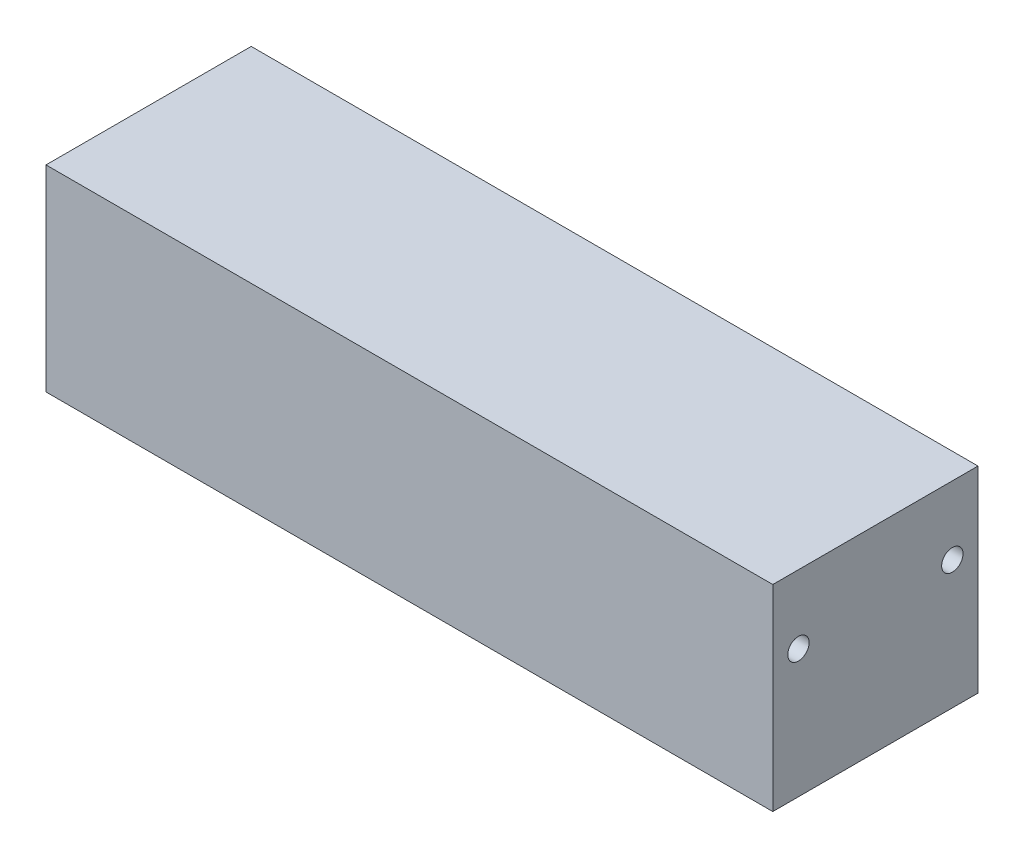
from build123d import *

# Parameters (mm, degrees)
SKETCH1_W           = 85
SKETCH1_H           = 23
BOSS_EXTRUDE1_DEPTH = 24
SKETCH3_R           = 1.25
CUT_EXTRUDE1_DEPTH  = 4
SKETCH4_R           = 1.25
CUT_EXTRUDE2_DEPTH  = 4
SKETCH5_R           = 2
BOSS_EXTRUDE3_DEPTH = 10


with BuildPart() as part:
    # Sketch1 → Boss-Extrude1 (new body)
    with BuildSketch(Plane.XY):
        Rectangle(SKETCH1_W, SKETCH1_H)
    extrude(amount=BOSS_EXTRUDE1_DEPTH)

    # Sketch3 → Cut-Extrude1 (cut)
    with BuildSketch(Plane.XZ.offset(11.5)):
        with Locations((-25, 12)):
            Circle(SKETCH3_R)
        with Locations((25, 12)):
            Circle(SKETCH3_R)
    extrude(amount=-CUT_EXTRUDE1_DEPTH, mode=Mode.SUBTRACT)

    # Sketch4 → Cut-Extrude2 (cut)
    with BuildSketch(Plane(origin=(42.5, 0, 0), x_dir=(0, 0, -1), z_dir=(1, 0, 0))):
        with Locations((-3, 3.5)):
            Circle(SKETCH4_R)
        with Locations(Location((-21, 3.5, 0), (0, 0, 180))):
            Circle(SKETCH4_R)
    cut_extrude2 = extrude(amount=-CUT_EXTRUDE2_DEPTH, mode=Mode.SUBTRACT)

    # Mirror1: Cut-Extrude2 across plane
    add(cut_extrude2.mirror(Plane(origin=(0, 0, 0), x_dir=(0, 0, 1), z_dir=(1, 0, 0))), mode=Mode.SUBTRACT)

    # Sketch5 → Boss-Extrude3 (add)
    with BuildSketch(Plane.XZ.offset(11.5)):
        with Locations(Location((-34.5, 12, 0), (0, 0, 180))):
            Circle(SKETCH5_R)
    extrude(amount=BOSS_EXTRUDE3_DEPTH)


solid = part.part
